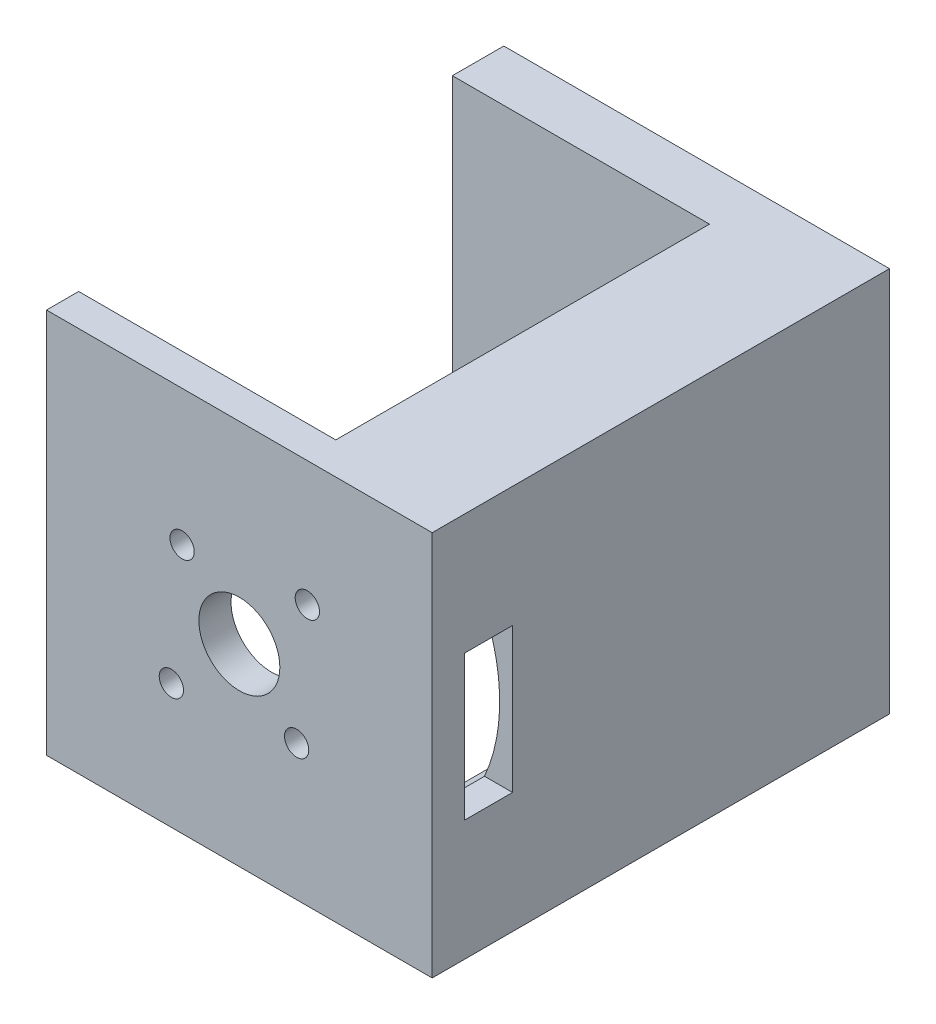
from build123d import *

# Parameters (mm, degrees)
SKETCH2_W           = 38.1
SKETCH2_H           = 38.1
BOSS_EXTRUDE1_DEPTH = 3.175
BOSS_EXTRUDE2_DEPTH = 36.92
SKETCH5_R           = 6.35
BOSS_EXTRUDE3_DEPTH = 5.08
SKETCH8_W           = 4.7625
SKETCH8_H           = 14.2875
CUT_EXTRUDE1_DEPTH  = 60.820669505


with BuildPart() as part:
    # Sketch2 → Boss-Extrude1 (new body)
    with BuildSketch(Plane.XY):
        Rectangle(SKETCH2_W, SKETCH2_H)
        with BuildLine():
            ThreePointArc((5.517514421, 6.717514421), (6.717514421, 5.517514421), (7.917514421, 6.717514421))
            ThreePointArc((7.917514421, 6.717514421), (6.717514421, 7.917514421), (5.517514421, 6.717514421))
        make_face(mode=Mode.SUBTRACT)
        with BuildLine():
            ThreePointArc((4.456854249, -5.656854249), (5.656854249, -6.856854249), (6.856854249, -5.656854249))
            ThreePointArc((6.856854249, -5.656854249), (5.656854249, -4.456854249), (4.456854249, -5.656854249))
        make_face(mode=Mode.SUBTRACT)
        with BuildLine():
            ThreePointArc((-7.917514421, -6.717514421), (-6.717514421, -7.917514421), (-5.517514421, -6.717514421))
            ThreePointArc((-5.517514421, -6.717514421), (-6.717514421, -5.517514421), (-7.917514421, -6.717514421))
        make_face(mode=Mode.SUBTRACT)
        with BuildLine():
            ThreePointArc((-6.856854249, 5.656854249), (-5.656854249, 4.456854249), (-4.456854249, 5.656854249))
            ThreePointArc((-4.456854249, 5.656854249), (-5.656854249, 6.856854249), (-6.856854249, 5.656854249))
        make_face(mode=Mode.SUBTRACT)
        with BuildLine():
            ThreePointArc((0, -4), (4, 0), (0, 4))
            ThreePointArc((0, 4), (-4, 0), (0, -4))
        make_face(mode=Mode.SUBTRACT)
    extrude(amount=BOSS_EXTRUDE1_DEPTH)

    # Sketch3 → Boss-Extrude2 (add)
    with BuildSketch(Plane(origin=(0, 0, 0), x_dir=(-1, 0, 0), z_dir=(0, 0, -1))):
        with BuildLine():
            Line((-19.05, -19.05), (-6.35, -19.05))
            Line((-6.35, -19.05), (-6.35, -16.607404975))
            ThreePointArc((-6.35, -16.607404975), (-17.78, 0), (-6.35, 16.607404975))
            Line((-6.35, 16.607404975), (-6.35, 19.05))
            Line((-6.35, 19.05), (-19.05, 19.05))
            Line((-19.05, 19.05), (-19.05, -19.05))
        make_face()
    extrude(amount=BOSS_EXTRUDE2_DEPTH)

    # Sketch5 → Boss-Extrude3 (add)
    # profile 1 of 3: a face of its own
    with BuildSketch(Plane(origin=(0, 0, -36.92), x_dir=(-1, 0, 0), z_dir=(0, 0, -1))):
        with BuildLine():
            Line((-6.35, -19.05), (19.05, -19.05))
            Line((19.05, -19.05), (19.05, 19.05))
            Line((19.05, 19.05), (-6.35, 19.05))
            Line((-6.35, 19.05), (-6.35, 16.607404975))
            ThreePointArc((-6.35, 16.607404975), (-17.78, 0), (-6.35, -16.607404975))
            Line((-6.35, -16.607404975), (-6.35, -19.05))
        make_face()
        with BuildLine():
            ThreePointArc((-14, 0), (0, 14), (14, 0))
            ThreePointArc((14, 0), (0, -14), (-14, 0))
        make_face(mode=Mode.SUBTRACT)
    # profile 2 of 3: a face of its own
    with BuildSketch(Plane(origin=(0, 0, -36.92), x_dir=(-1, 0, 0), z_dir=(0, 0, -1))):
        with BuildLine():
            ThreePointArc((14, 0), (0, 14), (-14, 0))
            ThreePointArc((-14, 0), (0, -14), (14, 0))
        make_face()
        Circle(SKETCH5_R, mode=Mode.SUBTRACT)
    # profile 3 of 3: a face of its own
    with BuildSketch(Plane(origin=(0, 0, -36.92), x_dir=(-1, 0, 0), z_dir=(0, 0, -1))):
        with BuildLine():
            Line((-6.35, -19.05), (-6.35, -16.607404975))
            ThreePointArc((-6.35, -16.607404975), (-17.78, 0), (-6.35, 16.607404975))
            Line((-6.35, 16.607404975), (-6.35, 19.05))
            Line((-6.35, 19.05), (-19.05, 19.05))
            Line((-19.05, 19.05), (-19.05, -19.05))
            Line((-19.05, -19.05), (-6.35, -19.05))
        make_face()
    extrude(amount=BOSS_EXTRUDE3_DEPTH)

    # Sketch8 → Cut-Extrude1 (cut, through all)
    with BuildSketch(Plane(origin=(19.05, 0, 0), x_dir=(0, 0, -1), z_dir=(1, 0, 0))):
        with Locations((2.38125, 0)):
            Rectangle(SKETCH8_W, SKETCH8_H)
    extrude(amount=-CUT_EXTRUDE1_DEPTH, mode=Mode.SUBTRACT)


solid = part.part
